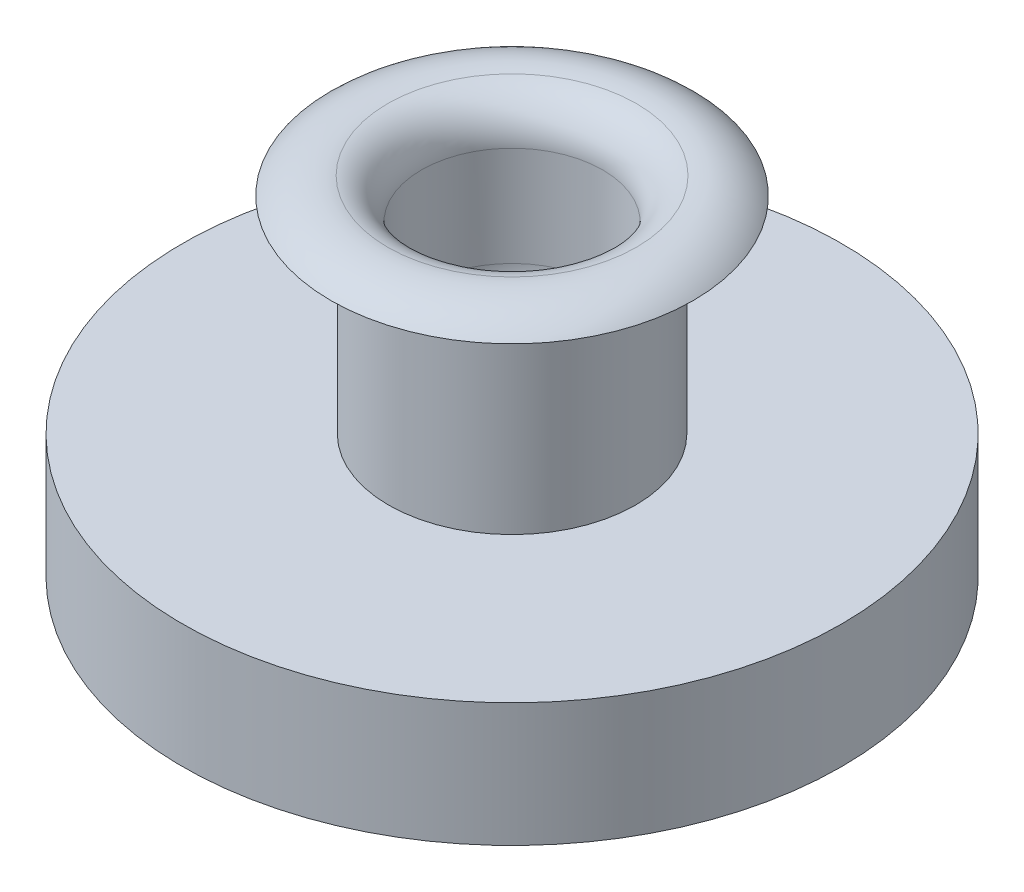
from build123d import *

# Parameters (mm, degrees)
FILLET1_R           = 0.8
FILLET2_R           = 0.5
SKETCH2_R           = 4
BOSS_EXTRUDE1_DEPTH = 1.5


with BuildPart() as part:
    # Sketch1 → Revolve1 (revolve)
    with BuildSketch(Plane.XY, mode=Mode.PRIVATE) as revolve1_sk:
        with BuildLine():
            Line((-1.5, 1), (-2.2, 1))
            ThreePointArc((-2.2, 1), (-1.65, 1.227674865), (-1.1, 1))
            Line((-1.1, 1), (-1.1, -1.178331311))
            Line((-1.1, -1.178331311), (0, -1.341209536))
            Line((0, -1.341209536), (0, -1.5))
            Line((0, -1.5), (-1.5, -1.5))
            Line((-1.5, -1.5), (-1.5, 1))
        make_face()
    revolve(revolve1_sk.sketch.rotate(Axis((0, -1.5, 0), (0, 1, 0)), 180), axis=Axis((0, -1.5, 0), (0, 1, 0)))

    # Fillet1
    fillet1_edges = [part.edges().sort_by_distance(p)[0] for p in [
        (-1.1, -1.178331311, 0),
    ]]
    fillet(fillet1_edges, radius=FILLET1_R)

    # Fillet2
    fillet2_edges = [part.edges().sort_by_distance(p)[0] for p in [
        (-1.1, 1, 0),
    ]]
    fillet(fillet2_edges, radius=FILLET2_R)

    # Sketch2 → Boss-Extrude1 (add)
    with BuildSketch(Plane.XZ.offset(1.5)):
        Circle(SKETCH2_R)
    extrude(amount=BOSS_EXTRUDE1_DEPTH)


solid = part.part
